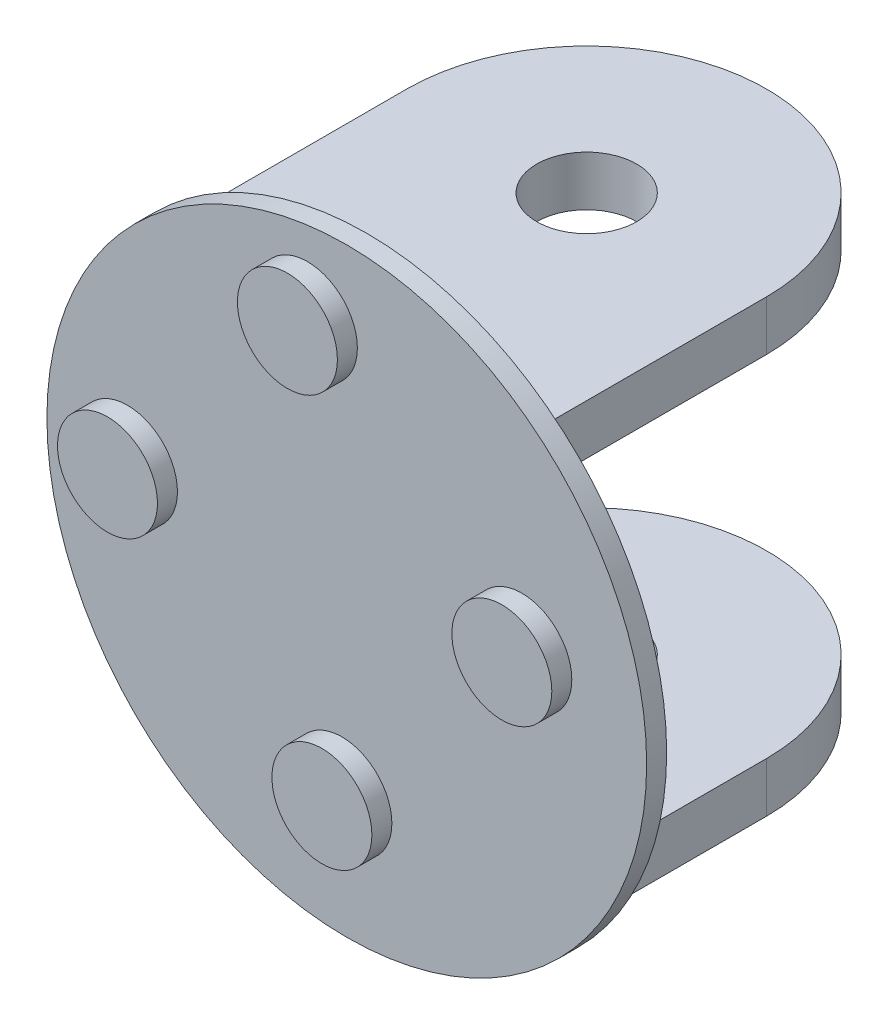
from build123d import *

# Parameters (mm, degrees)
SKETCH1_R           = 30
BOSS_EXTRUDE1_DEPTH = 2
SKETCH3_W           = 36
SKETCH3_H           = 5
BOSS_EXTRUDE3_DEPTH = 22
BOSS_EXTRUDE4_DEPTH = 5
SKETCH6_R           = 5
CUT_EXTRUDE1_DEPTH  = 22
SKETCH7_R           = 5
BOSS_EXTRUDE5_DEPTH = 2


with BuildPart() as part:
    # Sketch1 → Boss-Extrude1 (new body)
    with BuildSketch(Plane.XY):
        Circle(SKETCH1_R)
    extrude(amount=-BOSS_EXTRUDE1_DEPTH)

    # Sketch3 → Boss-Extrude3 (add)
    with BuildSketch(Plane(origin=(0, 0, -2), x_dir=(-1, 0, 0), z_dir=(0, 0, -1))):
        with Locations((0, -20)):
            Rectangle(SKETCH3_W, SKETCH3_H)
    boss_extrude3 = extrude(amount=BOSS_EXTRUDE3_DEPTH)

    # Sketch5 → Boss-Extrude4 (add)
    with BuildSketch(Plane.XZ.offset(22.5)):
        with BuildLine():
            Line((-18, -24), (18, -24))
            ThreePointArc((18, -24), (0, -42), (-18, -24))
        make_face()
    boss_extrude4 = extrude(amount=-BOSS_EXTRUDE4_DEPTH)

    # Sketch6 → Cut-Extrude1 (cut)
    with BuildSketch(Plane(origin=(0, -17.5, 0), x_dir=(1, 0, 0), z_dir=(0, 1, 0))):
        with Locations(Location((0, 24, 0), (0, 0, 180))):
            Circle(SKETCH6_R)
    cut_extrude1 = extrude(amount=-CUT_EXTRUDE1_DEPTH, mode=Mode.SUBTRACT)

    # Mirror2: Boss-Extrude3, Boss-Extrude4, Cut-Extrude1 across plane
    add(boss_extrude3.mirror(Plane.ZX))
    add(boss_extrude4.mirror(Plane.ZX))
    add(cut_extrude1.mirror(Plane.ZX), mode=Mode.SUBTRACT)

    # Sketch7 → Boss-Extrude5 (add)
    with BuildSketch(Plane.XY):
        with Locations((-3.94, 21.58)):
            Circle(SKETCH7_R)
        with Locations((-21.94, 0.13)):
            Circle(SKETCH7_R)
        with Locations((-0.49, -17.87)):
            Circle(SKETCH7_R)
        with Locations((17.51, 3.58)):
            Circle(SKETCH7_R)
    extrude(amount=BOSS_EXTRUDE5_DEPTH)


solid = part.part
